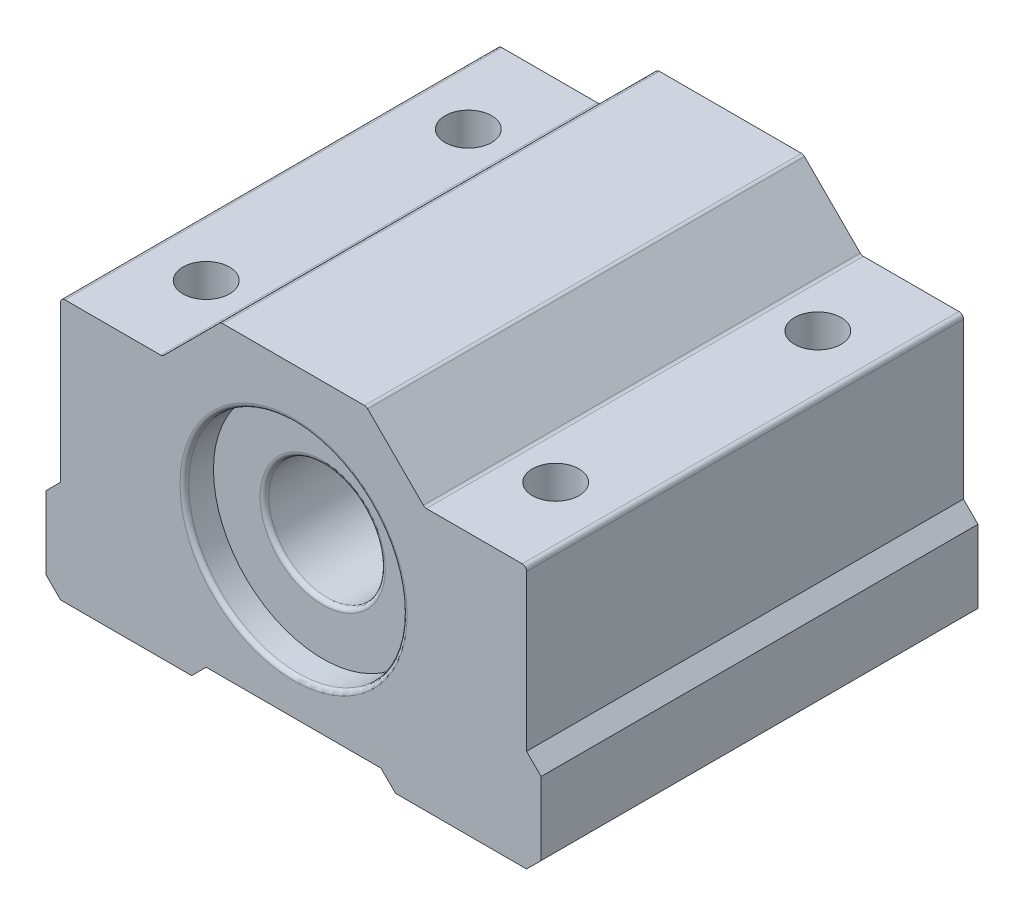
from build123d import *

# Parameters (mm, degrees)
SKETCH2_R           = 4
BOSS_EXTRUDE1_DEPTH = 15
SKETCH3_R           = 7.5
CUT_EXTRUDE1_DEPTH  = 2
SKETCH4_R           = 1.6
CUT_EXTRUDE2_DEPTH  = 32.591137998
CHAMFER1_SIZE       = 1
FILLET1_R           = 0.3


with BuildPart() as part:
    # Sketch2 → Boss-Extrude1 (new, symmetric)
    with BuildSketch(Plane.XY):
        Polygon((6, 1), (-6, 1), (-7, 0), (-17, 0), (-17, 6), (-16, 7), (-16, 18), (-9, 18), (-5, 22), (5, 22), (9, 18), (16, 18), (16, 7), (17, 6), (17, 0), (7, 0), align=None)
        with Locations((0, 11)):
            Circle(SKETCH2_R, mode=Mode.SUBTRACT)
    extrude(amount=BOSS_EXTRUDE1_DEPTH, both=True)

    # Sketch3 → Cut-Extrude1 (cut)
    with BuildSketch(Plane(origin=(0, 0, -15), x_dir=(-1, 0, 0), z_dir=(0, 0, -1))):
        with Locations((0, 11)):
            Circle(SKETCH3_R)
    cut_extrude1 = extrude(amount=-CUT_EXTRUDE1_DEPTH, mode=Mode.SUBTRACT)

    # Mirror1: Cut-Extrude1 across plane
    add(cut_extrude1.mirror(Plane.XY), mode=Mode.SUBTRACT)

    # Sketch4 → Cut-Extrude2 (cut, through all)
    with BuildSketch(Plane(origin=(0, 0, 0), x_dir=(-1, 0, 0), z_dir=(0, -1, 0))):
        with Locations(Location((-12, 9, 0), (0, 0, 180))):
            Circle(SKETCH4_R)
        with Locations(Location((12, 9, 0), (0, 0, 90))):
            Circle(SKETCH4_R)
        with Locations(Location((-12, -9, 0), (0, 0, 180))):
            Circle(SKETCH4_R)
        with Locations(Location((12, -9, 0), (0, 0, 90))):
            Circle(SKETCH4_R)
    extrude(amount=-CUT_EXTRUDE2_DEPTH, mode=Mode.SUBTRACT)

    # Chamfer1
    chamfer1_edges = [part.edges().sort_by_distance(p)[0] for p in [
        (-17, 0, 0),
        (17, 0, 0),
    ]]
    chamfer(chamfer1_edges, length=CHAMFER1_SIZE)

    # Fillet1
    fillet1_edges = [part.edges().sort_by_distance(p)[0] for p in [
        (-16, 18, 0),
        (-9, 18, 0),
        (-5, 22, 0),
        (5, 22, 0),
        (9, 18, 0),
        (16, 18, 0),
        (-4, 11, -13),
        (7.5, 11, -15),
        (7.5, 11, 15),
        (-4, 11, 13),
    ]]
    fillet(fillet1_edges, radius=FILLET1_R)


solid = part.part
